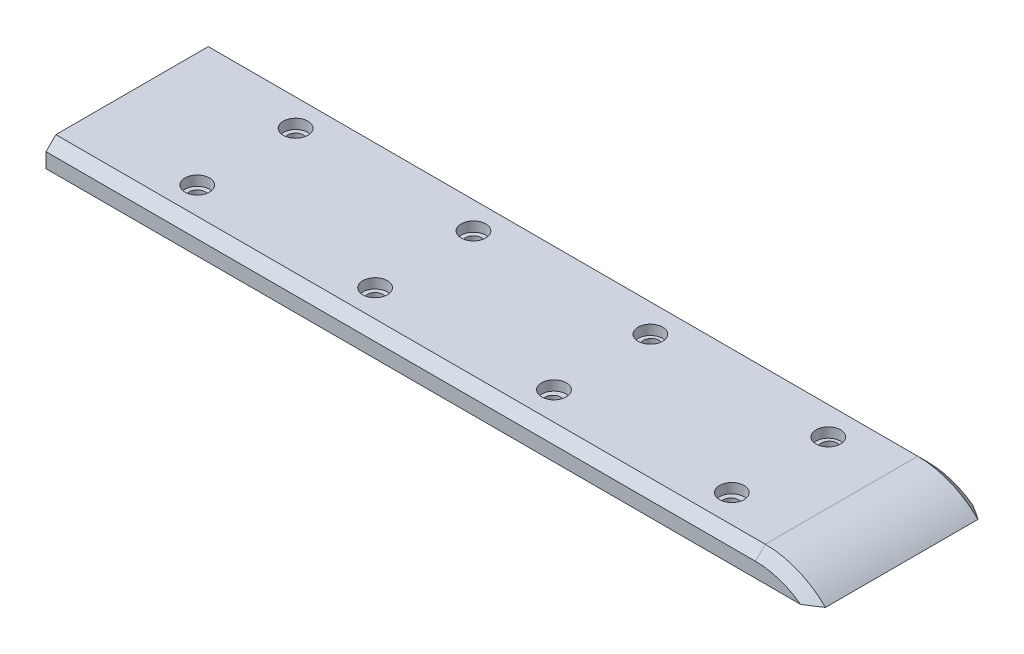
from build123d import *

# Parameters (mm, degrees)
BOSS_EXTRUDE1_DEPTH = 17.5
SKETCH2_W           = 18
SKETCH2_H           = 5
CUT_EXTRUDE1_DEPTH  = 17.5
SKETCH3_R           = 1.625
CUT_EXTRUDE2_DEPTH  = 5
SKETCH4_R           = 2.5
CUT_EXTRUDE3_DEPTH  = 2
CHAMFER1_SIZE       = 2


with BuildPart() as part:
    # Sketch1 → Boss-Extrude1 (new, symmetric)
    with BuildSketch(Plane.XY):
        with BuildLine():
            Line((-75, 17.5), (75, 17.5))
            ThreePointArc((75, 17.5), (81.614378278, 16.201851746), (87.247448714, 12.5))
            Line((87.247448714, 12.5), (-87.247448714, 12.5))
            ThreePointArc((-87.247448714, 12.5), (-81.614378278, 16.201851746), (-75, 17.5))
        make_face()
    extrude(amount=BOSS_EXTRUDE1_DEPTH, both=True)

    # Sketch2 → Cut-Extrude1 (cut, symmetric)
    with BuildSketch(Plane.XY):
        with Locations((-78.247448714, 15)):
            Rectangle(SKETCH2_W, SKETCH2_H)
    extrude(amount=CUT_EXTRUDE1_DEPTH, both=True, mode=Mode.SUBTRACT)

    # Sketch3 → Cut-Extrude2 (cut)
    with BuildSketch(Plane.XZ.offset(-12.5)):
        with Locations((-46, -10)):
            Circle(SKETCH3_R)
        with Locations((-9.833333333, -10)):
            Circle(SKETCH3_R)
        with Locations((26.333333333, -10)):
            Circle(SKETCH3_R)
        with Locations((62.5, -10)):
            Circle(SKETCH3_R)
    cut_extrude2 = extrude(amount=-CUT_EXTRUDE2_DEPTH, mode=Mode.SUBTRACT)

    # Sketch4 → Cut-Extrude3 (cut)
    with BuildSketch(Plane(origin=(0, 17.5, 0), x_dir=(1, 0, 0), z_dir=(0, 1, 0))):
        with Locations(Location((62.5, 9.8, 0), (0, 0, 180))):
            Circle(SKETCH4_R)
        with Locations(Location((26.333333333, 9.8, 0), (0, 0, 180))):
            Circle(SKETCH4_R)
        with Locations(Location((-9.833333333, 10, 0), (0, 0, 180))):
            Circle(SKETCH4_R)
        with Locations(Location((-46, 10, 0), (0, 0, 180))):
            Circle(SKETCH4_R)
    cut_extrude3 = extrude(amount=-CUT_EXTRUDE3_DEPTH, mode=Mode.SUBTRACT)

    # Mirror1: Cut-Extrude2, Cut-Extrude3 across plane
    add(cut_extrude2.mirror(Plane.XY), mode=Mode.SUBTRACT)
    add(cut_extrude3.mirror(Plane.XY), mode=Mode.SUBTRACT)

    # Chamfer1
    chamfer1_edges = [part.edges().sort_by_distance(p)[0] for p in [
        (81.614378278, 16.201851746, 17.5),
        (2.876275643, 17.5, 17.5),
        (2.876275643, 17.5, -17.5),
        (81.614378278, 16.201851746, -17.5),
    ]]
    chamfer(chamfer1_edges, length=CHAMFER1_SIZE)


solid = part.part
